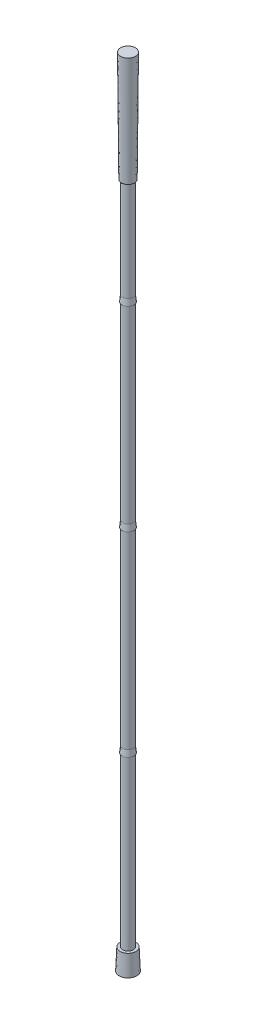
from build123d import *

# Parameters (mm, degrees)
SKETCH14_W = 8.1026
SKETCH14_H = 257.175


with BuildPart() as part:
    # Sketch3 → Revolve1 (revolve)
    with BuildSketch(Plane.XY, mode=Mode.PRIVATE) as revolve1_sk:
        Polygon((0, -1184.275), (0, -1216.025), (13.3985, -1216.025), (12.08405, -1184.275), align=None)
    revolve(revolve1_sk.sketch.rotate(Axis((0, -1184.275, 0), (0, -1, 0)), 180), axis=Axis((0, -1184.275, 0), (0, -1, 0)))



with BuildPart() as body_2:
    # Sketch1 → Revolve3 (revolve)
    with BuildSketch(Plane.XY, mode=Mode.PRIVATE) as revolve3_sk:
        Polygon((0, 0), (11.354913135, 0), (9.947052362, -168.275), (0, -168.275), align=None)
    revolve(revolve3_sk.sketch.rotate(Axis((0, 0, 0), (0, -1, 0)), 180), axis=Axis((0, 0, 0), (0, -1, 0)))

    # Sketch8 → Revolve4 (revolve)
    with BuildSketch(Plane.XY, mode=Mode.PRIVATE) as revolve4_sk:
        Polygon((0, -168.275), (0, -320.675), (0, -330.2), (9.144, -330.2), (8.07085, -320.675), (8.07085, -168.275), align=None)
    revolve(revolve4_sk.sketch.rotate(Axis((0, -168.275, 0), (0, -1, 0)), 180), axis=Axis((0, -168.275, 0), (0, -1, 0)))

    # Sketch11 → Revolve5 (revolve)
    with BuildSketch(Plane.XY, mode=Mode.PRIVATE) as revolve5_sk:
        Polygon((0, -330.2), (0, -619.125), (0, -628.65), (9.144, -628.65), (8.0645, -619.125), (8.0645, -330.2), align=None)
    revolve(revolve5_sk.sketch.rotate(Axis((0, -330.2, 0), (0, -1, 0)), 180), axis=Axis((0, -330.2, 0), (0, -1, 0)))

    # Sketch13 → Revolve6 (revolve)
    with BuildSketch(Plane.XY, mode=Mode.PRIVATE) as revolve6_sk:
        Polygon((0, -628.65), (8.04545, -628.65), (8.04545, -917.575), (9.144, -927.1), (0, -927.1), align=None)
    revolve(revolve6_sk.sketch.rotate(Axis((0, -628.65, 0), (0, -1, 0)), 180), axis=Axis((0, -628.65, 0), (0, -1, 0)))


with BuildPart() as part_1:
    add(part.part)

    add(body_2.part)  # Revolve7 merges body 2
    # Sketch14 → Revolve7 (revolve)
    with BuildSketch(Plane.XY, mode=Mode.PRIVATE) as revolve7_sk:
        with Locations((4.0513, -1055.6875)):
            Rectangle(SKETCH14_W, SKETCH14_H)
    revolve(revolve7_sk.sketch.rotate(Axis((0, -927.1, 0), (0, -1, 0)), 180), axis=Axis((0, -927.1, 0), (0, -1, 0)))


solid = part_1.part
